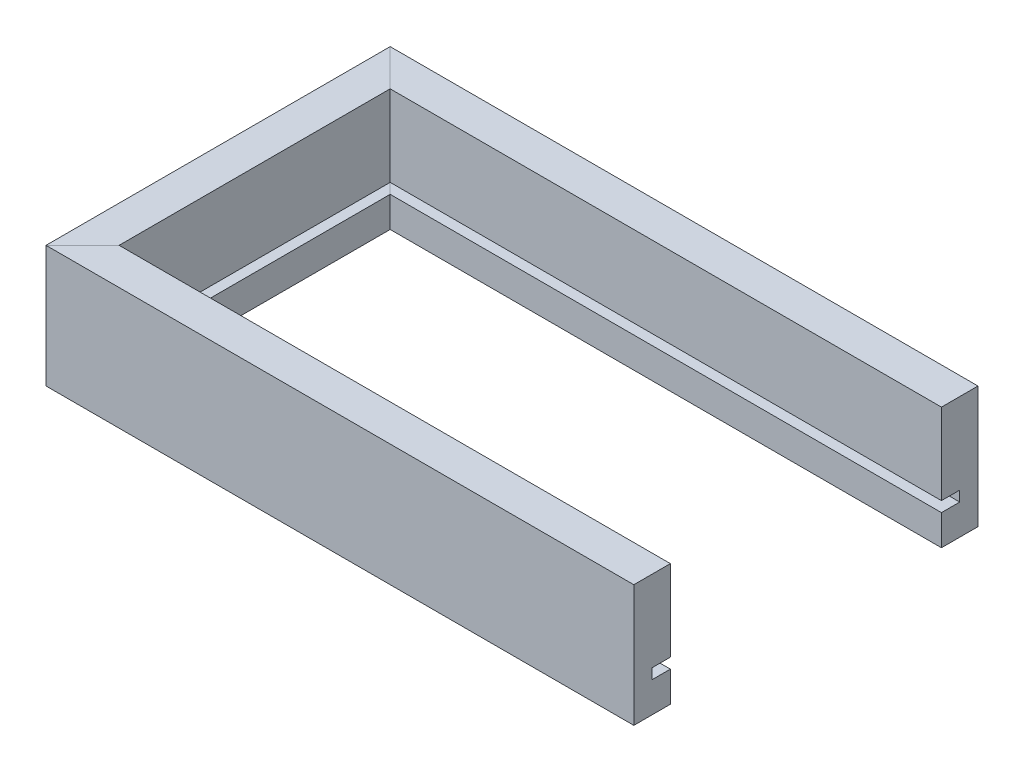
from build123d import *


with BuildPart() as part:
    # Sweep1: sweep along a path in Sketch1
    with BuildLine(Plane(origin=(0, 0, 0), x_dir=(1, 0, 0), z_dir=(0, 1, 0))) as sweep1_path:
        Line((46.75, -25.25), (-46.75, -25.25))
        Line((-46.75, -25.25), (-46.75, 25.25))
        Line((-46.75, 25.25), (46.75, 25.25))
    # Sketch2 → Sweep1 (sweep)
    with BuildSketch(Plane(origin=(46.75, 0, 0), x_dir=(0, 0, -1), z_dir=(1, 0, 0))):
        Polygon((-25.25, 0.85), (-25.25, -0.85), (-22.25, -0.85), (-22.25, -5.85), (-28.25, -5.85), (-28.25, 14.15), (-22.25, 14.15), (-22.25, 0.85), align=None)
    sweep(path=sweep1_path.line, transition=Transition.RIGHT)


solid = part.part
